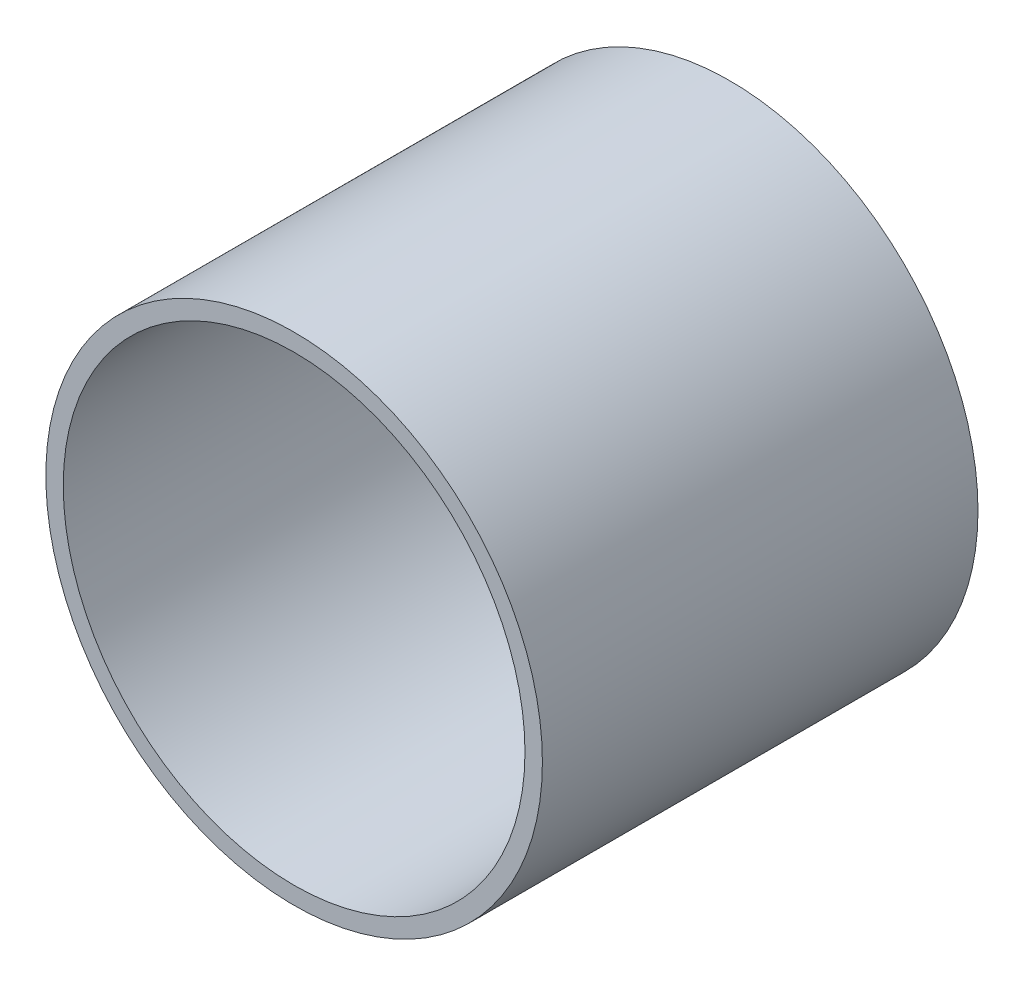
from build123d import *

# Parameters (mm, degrees)
SKETCH1_R           = 285
BOSS_EXTRUDE2_DEPTH = 500
SKETCH2_R           = 265
CUT_EXTRUDE1_DEPTH  = 499


with BuildPart() as part:
    # Sketch1 → Boss-Extrude2 (new body)
    with BuildSketch(Plane.XY):
        Circle(SKETCH1_R)
    extrude(amount=BOSS_EXTRUDE2_DEPTH)

    # Sketch2 → Cut-Extrude1 (cut)
    with BuildSketch(Plane.XY.offset(500)):
        Circle(SKETCH2_R)
    extrude(amount=-CUT_EXTRUDE1_DEPTH, mode=Mode.SUBTRACT)


solid = part.part
